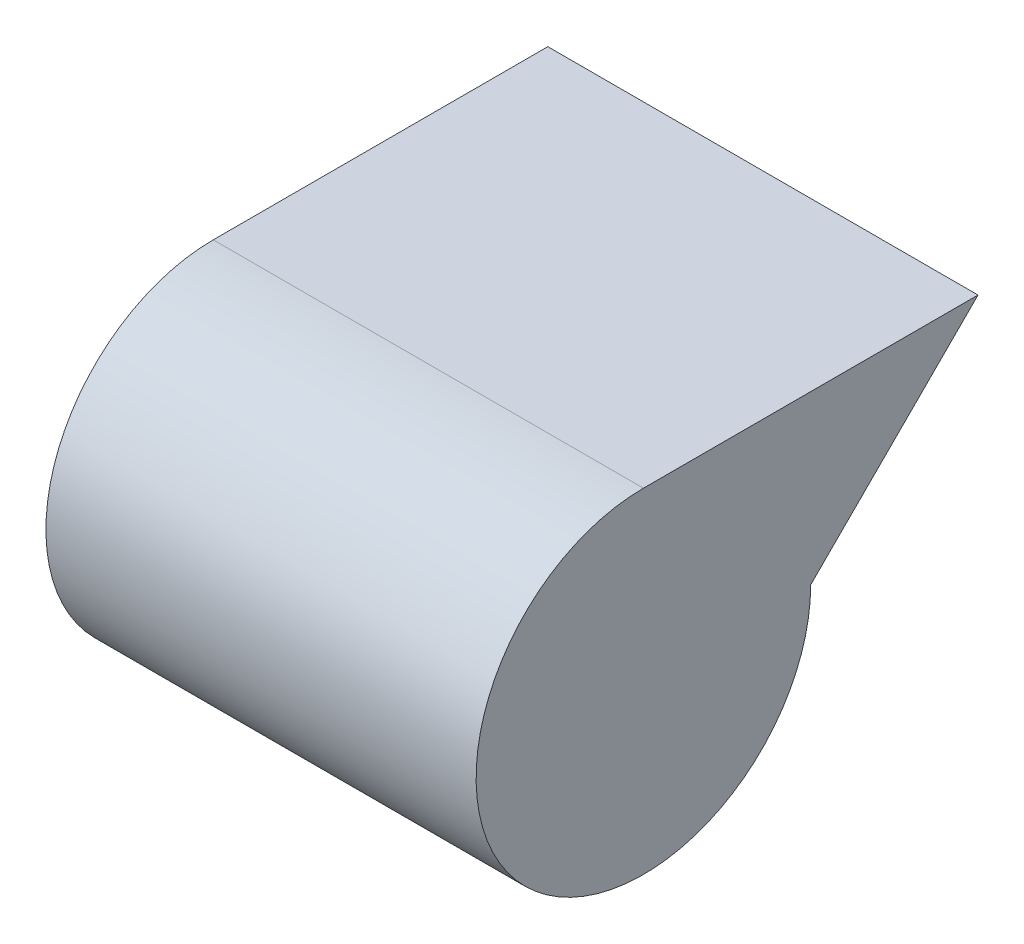
from build123d import *

# Parameters (mm, degrees)
SKETCH_1_R      = 35
EXTRUDE_1_DEPTH = 90
EXTRUDE_2_DEPTH = 90


with BuildPart() as part:
    # 草图1 → 凸台-拉伸1 (new body)
    with BuildSketch(Plane(origin=(0, 0, 0), x_dir=(0, 0, -1), z_dir=(1, 0, 0))):
        with Locations(Location((0, 0, 0), (0, 0, 180))):
            Circle(SKETCH_1_R)
    extrude(amount=EXTRUDE_1_DEPTH)

    # 草图3 → 凸台-拉伸2 (add)
    with BuildSketch(Plane(origin=(0, 0, 0), x_dir=(0, 0, -1), z_dir=(1, 0, 0))):
        Polygon((0, 35), (65.194417274, 35), (70, 35), (0, -35), align=None)
    extrude(amount=EXTRUDE_2_DEPTH)


solid = part.part
